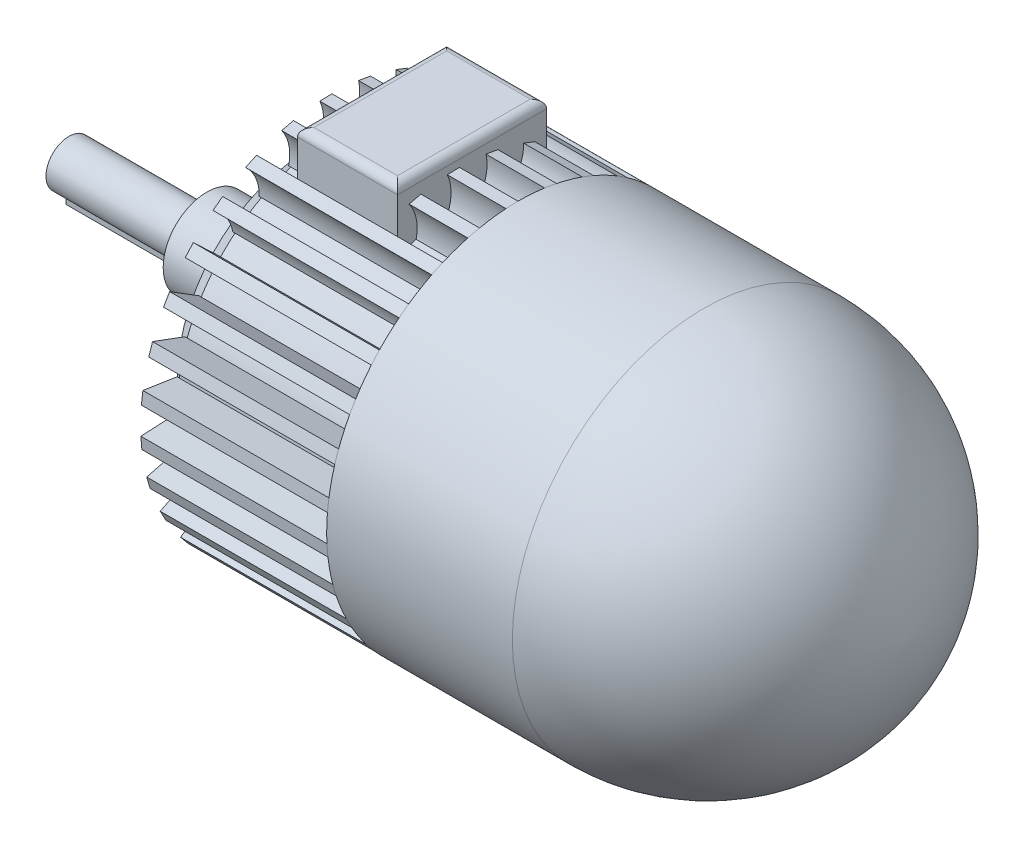
from build123d import *

# Parameters (mm, degrees)
BOSS_EXTRUDE1_DEPTH = 27
CIRPATTERN1_COUNT   = 31
BOSS_EXTRUDE2_REACH = 134.562
SKETCH3_W           = 14.527564724
SKETCH3_H           = 21.637263612
FILLET1_R           = 1.2
SKETCH4_R           = 3.330242916
BOSS_EXTRUDE3_DEPTH = 20
BOSS_EXTRUDE4_REACH = 129.912
SKETCH5_W           = 1.037544619
SKETCH5_H           = 1.760438402


with BuildPart() as part:
    # Sketch1 → Revolve1 (revolve)
    with BuildSketch(Plane.XY, mode=Mode.PRIVATE) as revolve1_sk:
        with BuildLine():
            Line((14.835685253, 0), (14.835685253, 6.327073891))
            Line((14.835685253, 6.327073891), (29.657803747, 6.327073891))
            Line((29.657803747, 6.327073891), (29.657803747, 19.077283347))
            Line((29.657803747, 19.077283347), (33.323488965, 22.742968566))
            Line((33.323488965, 22.742968566), (60.002583426, 22.742968566))
            Line((60.002583426, 22.742968566), (60.002583426, 27.76336354))
            Line((60.002583426, 27.76336354), (86.937400903, 27.76336354))
            ThreePointArc((86.937400903, 27.76336354), (107.04830062, 19.709310079), (116.040472815, 0))
            Line((116.040472815, 0), (14.835685253, 0))
        make_face()
    revolve(revolve1_sk.sketch.rotate(Axis((0, 0, 0), (1, 0, 0)), 90), axis=Axis((0, 0, 0), (1, 0, 0)))

    # Sketch2 → Boss-Extrude1 (add)
    with BuildSketch(Plane.ZY.offset(-60.002583426)):
        with BuildLine():
            Line((0, 22.742968566), (0, 27.76336354))
            Line((0, 27.76336354), (1.753072319, 27.707960814))
            ThreePointArc((1.753072319, 27.707960814), (1.206739892, 25.191631802), (1.753072319, 22.675302791))
            ThreePointArc((1.753072319, 22.675302791), (0.877188864, 22.726045826), (0, 22.742968566))
        make_face()
    boss_extrude1 = extrude(amount=BOSS_EXTRUDE1_DEPTH)

    # CirPattern1: Boss-Extrude1 ×31 about axis
    cirpattern1_axis = Axis((0, 0, 0), (1, 0, 0))
    for i in range(1, CIRPATTERN1_COUNT):
        add(boss_extrude1.rotate(cirpattern1_axis, i * 360 / CIRPATTERN1_COUNT))

    # Sketch3 → Boss-Extrude2 (add, up to next)
    with BuildSketch(Plane(origin=(0, 30, 0), x_dir=(1, 0, 0), z_dir=(0, 1, 0)), mode=Mode.PRIVATE) as boss_extrude2_sk1:
        with Locations((44.23146668, 1.849808989)):
            Rectangle(SKETCH3_W, SKETCH3_H)
    boss_extrude2_tool1 = extrude(boss_extrude2_sk1.sketch, amount=-BOSS_EXTRUDE2_REACH, mode=Mode.PRIVATE) - part.part
    add(boss_extrude2_tool1.solids().sort_by_distance((44.231467, 30, -1.849809))[0])

    # Fillet1
    fillet1_edges = [part.edges().sort_by_distance(p)[0] for p in [
        (36.967684318, 30, -1.849808989),
        (44.23146668, 30, 8.968822817),
        (51.495249042, 30, -1.849808989),
        (44.23146668, 30, -12.668440795),
    ]]
    fillet(fillet1_edges, radius=FILLET1_R)

    # Sketch4 → Boss-Extrude3 (add)
    with BuildSketch(Plane.ZY.offset(-14.835685253)):
        Circle(SKETCH4_R)
    extrude(amount=BOSS_EXTRUDE3_DEPTH)

    # Sketch5 → Boss-Extrude4 (add, up to next)
    with BuildSketch(Plane.ZY.offset(5.164314747), mode=Mode.PRIVATE) as boss_extrude4_sk1:
        with Locations((-0.113693018, -4.149853047)):
            Rectangle(SKETCH5_W, SKETCH5_H)
    boss_extrude4_tool1 = extrude(boss_extrude4_sk1.sketch, amount=-BOSS_EXTRUDE4_REACH, mode=Mode.PRIVATE) - part.part
    add(boss_extrude4_tool1.solids().sort_by_distance((-5.164315, -4.149853, -0.113693))[0])


solid = part.part
